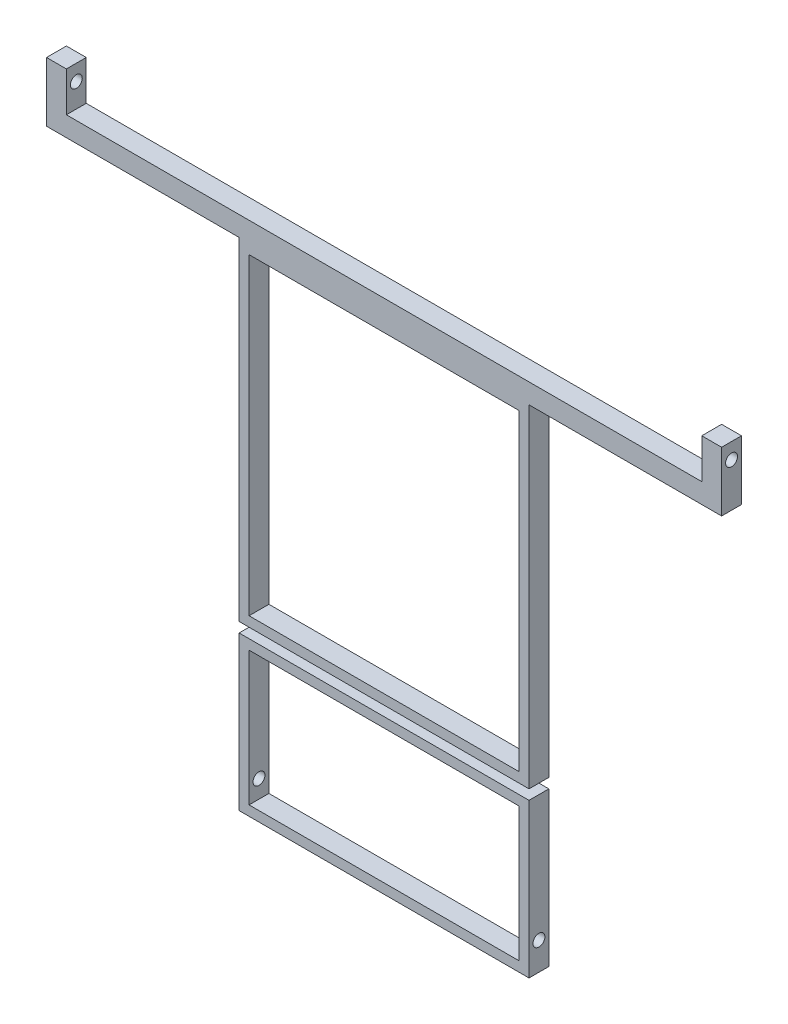
from build123d import *

# Parameters (mm, degrees)
BOSS_EXTRUDE1_DEPTH     = 25
SKETCH2_R               = 7.5
CUT_EXTRUDE1_DEPTH      = 10000
SKETCH3_W               = 365
SKETCH3_H               = 25
BOSS_EXTRUDE3_DEPTH     = 625
SKETCH4_W               = 340
SKETCH4_H               = 600
CUT_EXTRUDE2_DEPTH      = 625
SKETCH5_W               = 365
SKETCH5_H               = 37.5
BOSS_EXTRUDE4_DEPTH     = 25
SKETCH6_W               = 406.123907145
SKETCH6_H               = 12.5
CUT_EXTRUDE3_DEPTH      = 25
CUT_EXTRUDE4_DEPTH      = 891.045644897
CUT_EXTRUDE4_DEPTH_BACK = 891.045644897
SKETCH7_R               = 7.5


with BuildPart() as part:
    # Sketch1 → Boss-Extrude1 (new body)
    with BuildSketch(Plane.XY):
        Polygon((0, 0), (800, 0), (800, 50), (825, 50), (825, -25), (-25, -25), (-25, 50), (0, 50), align=None)
    extrude(amount=BOSS_EXTRUDE1_DEPTH)

    # Sketch2 → Cut-Extrude1 (cut)
    with BuildSketch(Plane(origin=(825, 0, 0), x_dir=(0, 0, -1), z_dir=(1, 0, 0))):
        with Locations(Location((-12.5, 30, 0), (0, 0, 90))):
            Circle(SKETCH2_R)
    extrude(amount=-CUT_EXTRUDE1_DEPTH, mode=Mode.SUBTRACT)

    # Sketch3 → Boss-Extrude3 (add)
    with BuildSketch(Plane.XZ.offset(25)):
        with Locations((400, 12.5)):
            Rectangle(SKETCH3_W, SKETCH3_H)
    extrude(amount=BOSS_EXTRUDE3_DEPTH)

    # Sketch4 → Cut-Extrude2 (cut)
    with BuildSketch(Plane.XY.offset(25)):
        with Locations((400, -337.5)):
            Rectangle(SKETCH4_W, SKETCH4_H)
    extrude(amount=-CUT_EXTRUDE2_DEPTH, mode=Mode.SUBTRACT)

    # Sketch5 → Boss-Extrude4 (add)
    with BuildSketch(Plane.XY):
        with Locations((400, -450.012397123)):
            Rectangle(SKETCH5_W, SKETCH5_H)
    extrude(amount=BOSS_EXTRUDE4_DEPTH)

    # Sketch6 → Cut-Extrude3 (cut)
    with BuildSketch(Plane.XY.offset(25)):
        with Locations((400.088829204, -450.012397123)):
            Rectangle(SKETCH6_W, SKETCH6_H)
    extrude(amount=-CUT_EXTRUDE3_DEPTH, mode=Mode.SUBTRACT)


with BuildPart() as cut_extrude3_piece_1:
    # of the separate pieces the step leaves, piece 1, a body of its own (cut_extrude3_pieces)
    add(part.part.solids().sort_by_distance((0, 0, 0))[0])


with BuildPart() as cut_extrude3_piece_2:
    # of the separate pieces the step leaves, piece 2, a body of its own (cut_extrude3_pieces)
    add(part.part.solids().sort_by_distance((217.5, -650, 0))[0])

    # Sketch7 → Cut-Extrude4 (cut, two sides: drawn at the far end of the back side and taken through both)
    with BuildSketch(Plane.ZY.offset(-217.5).offset(-CUT_EXTRUDE4_DEPTH_BACK)):
        with Locations((12.5, -615)):
            Circle(SKETCH7_R)
    extrude(amount=CUT_EXTRUDE4_DEPTH + CUT_EXTRUDE4_DEPTH_BACK, mode=Mode.SUBTRACT)


solid = Compound([cut_extrude3_piece_1.part, cut_extrude3_piece_2.part])
